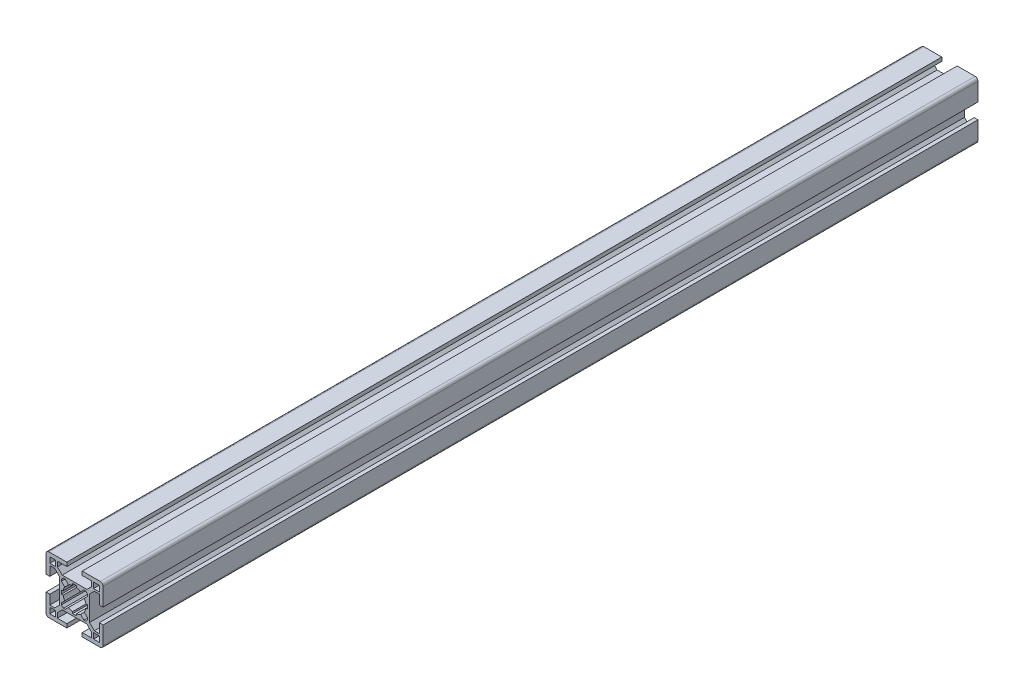
from build123d import *

# Parameters (mm, degrees)
ESBO_O1_W                = 3
ESBO_O1_H                = 3
RESSALTO_EXTRUS_O1_DEPTH = 230


with BuildPart() as part:
    # Esboço1 → Ressalto-extrusão1 (new, symmetric)
    with BuildSketch(Plane.XY):
        with BuildLine():
            Line((15, 13.5), (15, 4.05))
            Line((15, 4.05), (13, 4.05))
            Line((13, 4.05), (13, 9))
            Line((13, 9), (10.414213562, 9))
            Line((10.414213562, 9), (7.9, 6.485786438))
            Line((7.9, 6.485786438), (7.9, -7.36e-07))
            Line((7.9, -7.36e-07), (7.9, -6.485786438))
            Line((7.9, -6.485786438), (10.414213562, -9))
            Line((10.414213562, -9), (13, -9))
            Line((13, -9), (13, -4.05))
            Line((13, -4.05), (15, -4.05))
            Line((15, -4.05), (15, -13.5))
            ThreePointArc((15, -13.5), (14.560660172, -14.560660172), (13.5, -15))
            Line((13.5, -15), (4.05, -15))
            Line((4.05, -15), (4.05, -13))
            Line((4.05, -13), (9, -13))
            Line((9, -13), (9, -10.414213562))
            Line((9, -10.414213562), (6.485786438, -7.9))
            Line((6.485786438, -7.9), (-7.36e-07, -7.9))
            Line((-7.36e-07, -7.9), (-6.485786438, -7.9))
            Line((-6.485786438, -7.9), (-9, -10.414213562))
            Line((-9, -10.414213562), (-9, -13))
            Line((-9, -13), (-4.05, -13))
            Line((-4.05, -13), (-4.05, -15))
            Line((-4.05, -15), (-13.5, -15))
            ThreePointArc((-13.5, -15), (-14.560660172, -14.560660172), (-15, -13.5))
            Line((-15, -13.5), (-15, -4.05))
            Line((-15, -4.05), (-13, -4.05))
            Line((-13, -4.05), (-13, -9))
            Line((-13, -9), (-10.414213562, -9))
            Line((-10.414213562, -9), (-7.9, -6.485786438))
            Line((-7.9, -6.485786438), (-7.9, 7.36e-07))
            Line((-7.9, 7.36e-07), (-7.9, 6.485786438))
            Line((-7.9, 6.485786438), (-10.414213562, 9))
            Line((-10.414213562, 9), (-13, 9))
            Line((-13, 9), (-13, 4.05))
            Line((-13, 4.05), (-15, 4.05))
            Line((-15, 4.05), (-15, 13.5))
            ThreePointArc((-15, 13.5), (-14.560660172, 14.560660172), (-13.5, 15))
            Line((-13.5, 15), (-4.05, 15))
            Line((-4.05, 15), (-4.05, 13))
            Line((-4.05, 13), (-9, 13))
            Line((-9, 13), (-9, 10.414213562))
            Line((-9, 10.414213562), (-6.485786438, 7.9))
            Line((-6.485786438, 7.9), (7.36e-07, 7.9))
            Line((7.36e-07, 7.9), (6.485786438, 7.9))
            Line((6.485786438, 7.9), (9, 10.414213562))
            Line((9, 10.414213562), (9, 13))
            Line((9, 13), (4.05, 13))
            Line((4.05, 13), (4.05, 15))
            Line((4.05, 15), (13.5, 15))
            ThreePointArc((13.5, 15), (14.560660172, 14.560660172), (15, 13.5))
        make_face()
        with Locations((-11.5, 11.5)):
            Rectangle(ESBO_O1_W, ESBO_O1_H, mode=Mode.SUBTRACT)
        with BuildLine():
            Line((-6.9, 1.000000736), (-6.9, 7.36e-07))
            Line((-6.9, 7.36e-07), (-6.9, -1.000000736))
            Line((-6.9, -1.000000736), (-5.966782929, -1.000000736))
            ThreePointArc((-5.966782929, -1.000000736), (-5.665339038, -2.122836212), (-5.154690025, -3.167281286))
            Line((-5.154690025, -3.167281286), (-6.9, -4.91259126))
            Line((-6.9, -4.91259126), (-6.9, -5.827922061))
            Line((-6.9, -5.827922061), (-5.827922061, -6.9))
            Line((-5.827922061, -6.9), (-4.91259126, -6.9))
            Line((-4.91259126, -6.9), (-3.167281286, -5.154690025))
            ThreePointArc((-3.167281286, -5.154690025), (-2.122836212, -5.665339038), (-1.000000736, -5.966782929))
            Line((-1.000000736, -5.966782929), (-1.000000736, -6.9))
            Line((-1.000000736, -6.9), (-7.36e-07, -6.9))
            Line((-7.36e-07, -6.9), (1.000000736, -6.9))
            Line((1.000000736, -6.9), (1.000000736, -5.966782929))
            ThreePointArc((1.000000736, -5.966782929), (2.122836212, -5.665339038), (3.167281286, -5.154690025))
            Line((3.167281286, -5.154690025), (4.91259126, -6.9))
            Line((4.91259126, -6.9), (5.827922061, -6.9))
            Line((5.827922061, -6.9), (6.9, -5.827922061))
            Line((6.9, -5.827922061), (6.9, -4.91259126))
            Line((6.9, -4.91259126), (5.154690025, -3.167281286))
            ThreePointArc((5.154690025, -3.167281286), (5.665339038, -2.122836212), (5.966782929, -1.000000736))
            Line((5.966782929, -1.000000736), (6.9, -1.000000736))
            Line((6.9, -1.000000736), (6.9, -7.36e-07))
            Line((6.9, -7.36e-07), (6.9, 1.000000736))
            Line((6.9, 1.000000736), (5.966782929, 1.000000736))
            ThreePointArc((5.966782929, 1.000000736), (5.665339038, 2.122836212), (5.154690025, 3.167281286))
            Line((5.154690025, 3.167281286), (6.9, 4.91259126))
            Line((6.9, 4.91259126), (6.9, 5.827922061))
            Line((6.9, 5.827922061), (5.827922061, 6.9))
            Line((5.827922061, 6.9), (4.91259126, 6.9))
            Line((4.91259126, 6.9), (3.167281286, 5.154690025))
            ThreePointArc((3.167281286, 5.154690025), (2.122836212, 5.665339038), (1.000000736, 5.966782929))
            Line((1.000000736, 5.966782929), (1.000000736, 6.9))
            Line((1.000000736, 6.9), (7.36e-07, 6.9))
            Line((7.36e-07, 6.9), (-1.000000736, 6.9))
            Line((-1.000000736, 6.9), (-1.000000736, 5.966782929))
            ThreePointArc((-1.000000736, 5.966782929), (-2.122836212, 5.665339038), (-3.167281286, 5.154690025))
            Line((-3.167281286, 5.154690025), (-4.91259126, 6.9))
            Line((-4.91259126, 6.9), (-5.827922061, 6.9))
            Line((-5.827922061, 6.9), (-6.9, 5.827922061))
            Line((-6.9, 5.827922061), (-6.9, 4.91259126))
            Line((-6.9, 4.91259126), (-5.154690025, 3.167281286))
            ThreePointArc((-5.154690025, 3.167281286), (-5.665339038, 2.122836212), (-5.966782929, 1.000000736))
            Line((-5.966782929, 1.000000736), (-6.9, 1.000000736))
        make_face(mode=Mode.SUBTRACT)
        with Locations((11.5, 11.5)):
            Rectangle(ESBO_O1_W, ESBO_O1_H, mode=Mode.SUBTRACT)
        with Locations((11.5, -11.5)):
            Rectangle(ESBO_O1_W, ESBO_O1_H, mode=Mode.SUBTRACT)
        with Locations((-11.5, -11.5)):
            Rectangle(ESBO_O1_W, ESBO_O1_H, mode=Mode.SUBTRACT)
    extrude(amount=RESSALTO_EXTRUS_O1_DEPTH, both=True)


solid = part.part
